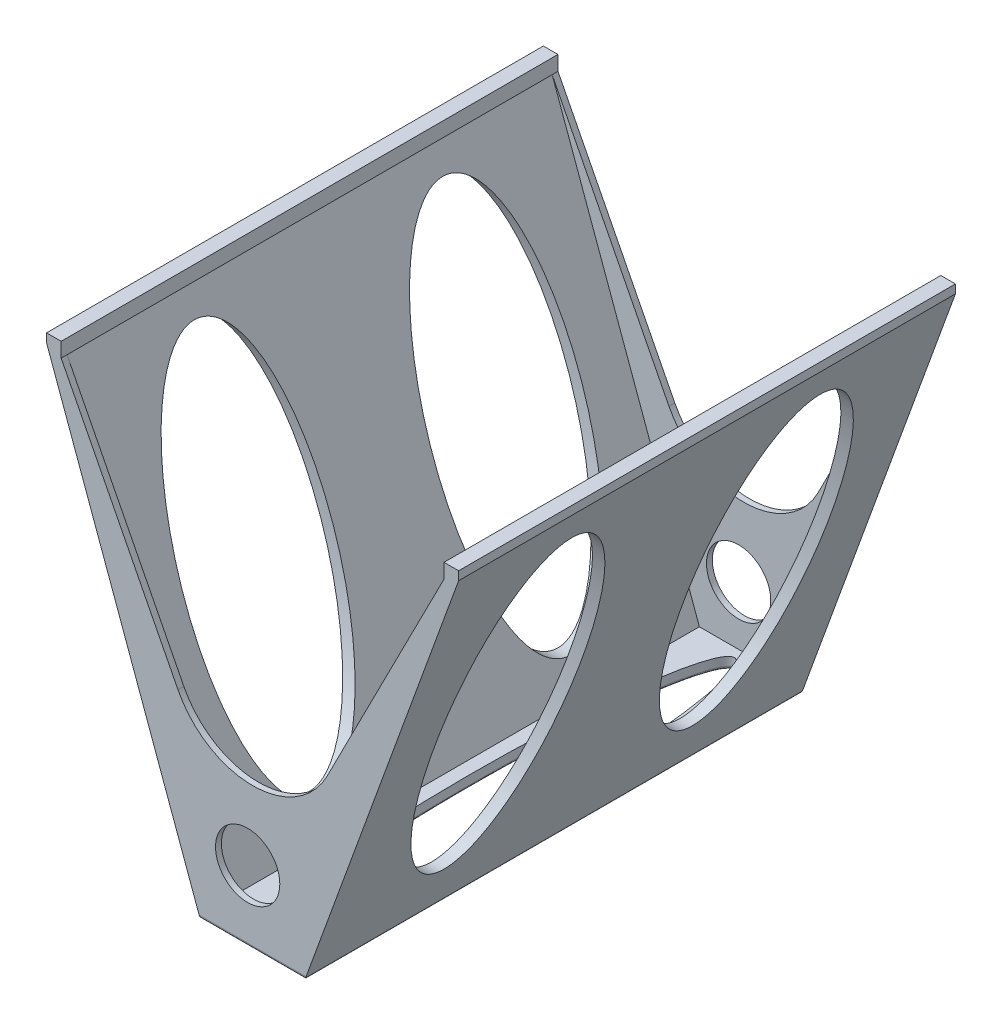
from build123d import *

# Parameters (mm, degrees)
SKETCH1_R           = 11
BOSS_EXTRUDE7_DEPTH = 2
BOSS_EXTRUDE8_DEPTH = 166
BOSS_EXTRUDE9_START = 2
SKETCH6_R           = 11
BOSS_EXTRUDE9_DEPTH = 2
SKETCH7_RX          = 79.859177977
SKETCH7_RY          = 10.592553842
CUT_EXTRUDE3_DEPTH  = 235.357297143
FILLET1_R           = 1
SKETCH8_RX          = 60
SKETCH8_RY          = 25
CUT_EXTRUDE4_DEPTH  = 260.665169069


with BuildPart() as part:
    # Sketch1 → Boss-Extrude7 (new body)
    with BuildSketch(Plane.XY):
        with BuildLine():
            Line((-65.5, 3.407912692), (-65.5, 8.407912692))
            Line((-65.5, 8.407912692), (-70.5, 8.407912692))
            Line((-70.5, 8.407912692), (-70.5, 5.450082189))
            Line((-70.5, 5.450082189), (-17.924469746, -139))
            Line((-17.924469746, -139), (17.924469746, -139))
            Line((17.924469746, -139), (70.5, 5.450082189))
            Line((70.5, 5.450082189), (70.5, 8.407912692))
            Line((70.5, 8.407912692), (65.5, 8.407912692))
            Line((65.5, 8.407912692), (65.5, 3.407912692))
            Line((65.5, 3.407912692), (25.525291769, -74.887353677))
            ThreePointArc((25.525291769, -74.887353677), (0, -90.514814417), (-25.525291769, -74.887353677))
            Line((-25.525291769, -74.887353677), (-65.5, 3.407912692))
        make_face()
        with Locations((-1.686782892, -115)):
            Circle(SKETCH1_R, mode=Mode.SUBTRACT)
    extrude(amount=BOSS_EXTRUDE7_DEPTH)

    # Sketch1<6> → Boss-Extrude8 (add)
    with BuildSketch(Plane.XY):
        Polygon((-65.5, 3.407912692), (-65.5, 8.407912692), (-70.5, 8.407912692), (-70.5, 5.450082189), (-17.924469746, -139), (17.924469746, -139), (70.5, 5.450082189), (70.5, 8.407912692), (65.5, 8.407912692), (65.5, 3.407912692), (15.123639593, -135), (-15.123639593, -135), align=None)
    extrude(amount=-BOSS_EXTRUDE8_DEPTH)

    # Sketch6 → Boss-Extrude9 (add)
    with BuildSketch(Plane(origin=(0, 0, -166), x_dir=(-1, 0, 0), z_dir=(0, 0, -1)).offset(BOSS_EXTRUDE9_START)):
        with BuildLine():
            Line((-17.924469746, -139), (17.924469746, -139))
            Line((17.924469746, -139), (70.5, 5.450082189))
            Line((70.5, 5.450082189), (70.5, 8.407912692))
            Line((70.5, 8.407912692), (65.5, 8.407912692))
            Line((65.5, 8.407912692), (65.5, 3.407912692))
            Line((65.5, 3.407912692), (25.525291769, -74.887353677))
            ThreePointArc((25.525291769, -74.887353677), (0, -90.514814417), (-25.525291769, -74.887353677))
            Line((-25.525291769, -74.887353677), (-65.5, 3.407912692))
            Line((-65.5, 3.407912692), (-65.5, 8.407912692))
            Line((-65.5, 8.407912692), (-70.5, 8.407912692))
            Line((-70.5, 8.407912692), (-70.5, 5.450082189))
            Line((-70.5, 5.450082189), (-17.924469746, -139))
        make_face()
        with Locations((1.686782892, -115)):
            Circle(SKETCH6_R, mode=Mode.SUBTRACT)
    extrude(amount=-BOSS_EXTRUDE9_DEPTH)

    # Sketch7 → Cut-Extrude3 (cut, through all)
    with BuildSketch(Plane.XZ.offset(139)):
        with Locations(Location((0, -83), (0, 0, -90))):
            Ellipse(SKETCH7_RX, SKETCH7_RY)
    extrude(amount=-CUT_EXTRUDE3_DEPTH, mode=Mode.SUBTRACT)

    # Fillet1
    fillet1_edges = [part.edges().sort_by_distance(p)[0] for p in [
        (0, -139, 2),
        (17.924469746, -139, -83),
        (0, -139, -168),
        (-17.924469746, -139, -83),
        (-1.776116577, -139, -4.27145509),
    ]]
    fillet(fillet1_edges, radius=FILLET1_R)

    # Sketch8 → Cut-Extrude4 (cut, through all)
    with BuildSketch(Plane.ZY.offset(70.5)):
        with Locations(Location((-125.5, -64.967053726), (0, 0, 90))):
            Ellipse(SKETCH8_RX, SKETCH8_RY)
        with Locations(Location((-40.5, -64.967053726), (0, 0, 90))):
            Ellipse(SKETCH8_RX, SKETCH8_RY)
    extrude(amount=-CUT_EXTRUDE4_DEPTH, mode=Mode.SUBTRACT)


solid = part.part
